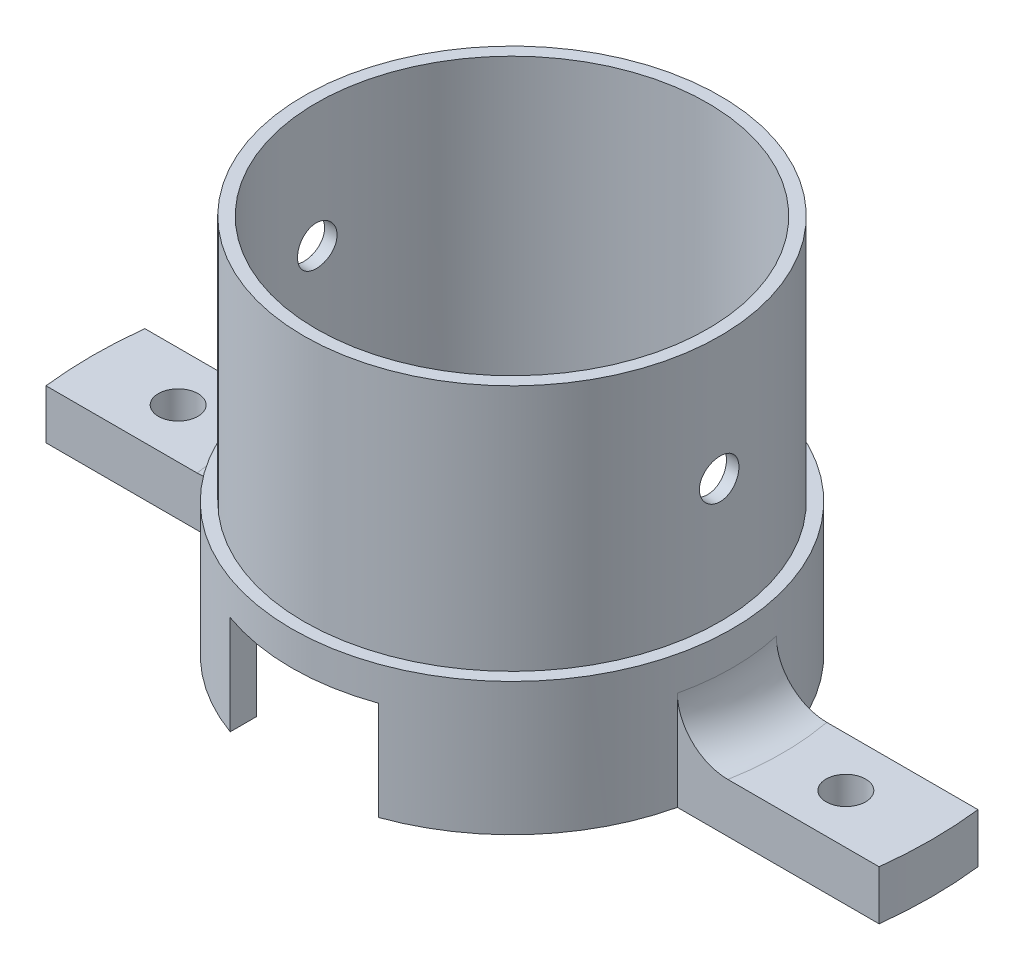
from build123d import *

# Parameters (mm, degrees)
SKETCH1_R                = 34
BOSS_EXTRUDE1_DEPTH      = 10
SKETCH2_R                = 19.7871926
SKETCH2_R_2              = 2
CUT_EXTRUDE1_DEPTH       = 10
SKETCH3_R                = 4.837531333
SKETCH4_W                = 4.837531333
SKETCH4_H                = 4.837531333
CUT_EXTRUDE3_DEPTH       = 38
CUT_EXTRUDE3_DEPTH_BACK  = 38
SKETCH5_W                = 72.361656805
SKETCH5_H                = 8.896778435
BOSS_EXTRUDE2_START      = 60
SKETCH6_R                = 22.2871926
SKETCH6_R_2              = 19.7871926
BOSS_EXTRUDE2_DEPTH      = 60
SKETCH7_R                = 21.0371926
SKETCH7_R_2              = 19.7871926
CUT_EXTRUDE4_DEPTH       = 25
CUT_EXTRUDE6_DEPTH       = 25
CUT_EXTRUDE6_DEPTH_BACK  = 25
SKETCH8_R                = 2
CUT_EXTRUDE7_DEPTH       = 43
CUT_EXTRUDE7_DEPTH_BACK  = 53
SKETCH9_W                = 69.351432881
SKETCH9_H                = 5.737807944
CUT_EXTRUDE8_START       = -25
SKETCH10_R               = 22.2871926
SKETCH10_R_2             = 21.0371926
CUT_EXTRUDE8_DEPTH       = 25
CUT_EXTRUDE9_DEPTH       = 30
CUT_EXTRUDE9_DEPTH_BACK  = 30
SKETCH11_R               = 2
CUT_EXTRUDE10_DEPTH      = 30
CUT_EXTRUDE10_DEPTH_BACK = 30
SKETCH12_W               = 44.5743852
SKETCH12_H               = 21.576749043
BOSS_EXTRUDE3_DEPTH      = 66
BOSS_EXTRUDE3_DEPTH_BACK = 54
SKETCH13_W               = 10
SKETCH13_H               = 10
CUT_EXTRUDE11_START      = -66
SKETCH14_R               = 19.7871926
CUT_EXTRUDE11_DEPTH      = 66
SKETCH18_W               = 9.329915791
SKETCH18_H               = 10
CUT_EXTRUDE12_DEPTH      = 66
SKETCH19_R               = 2
CUT_EXTRUDE13_DEPTH      = 66
SKETCH20_R               = 58.570053226
SKETCH20_R_2             = 42.40739525
CUT_EXTRUDE14_DEPTH      = 66
SKETCH22_R               = 21.0371926
SKETCH22_R_2             = 19.7871926
BOSS_EXTRUDE4_DEPTH      = 12
CUT_EXTRUDE15_DEPTH      = 66
CUT_EXTRUDE15_DEPTH_BACK = 66
SKETCH21_W               = 15
SKETCH21_H               = 10


with BuildPart() as part:
    # Sketch1 → Boss-Extrude1 (new body)
    with BuildSketch(Plane(origin=(0, 0, 0), x_dir=(1, 0, 0), z_dir=(0, 1, 0))):
        Circle(SKETCH1_R)
    extrude(amount=BOSS_EXTRUDE1_DEPTH)

    # Sketch2 → Cut-Extrude1 (cut)
    with BuildSketch(Plane.XZ):
        Circle(SKETCH2_R)
        with Locations((-22.1, 12.5)):
            Circle(SKETCH2_R_2)
        with Locations((22.1, 12.5)):
            Circle(SKETCH2_R_2)
        with Locations((22.1, -12.5)):
            Circle(SKETCH2_R_2)
        with Locations((-22.1, -12.5)):
            Circle(SKETCH2_R_2)
    extrude(amount=-CUT_EXTRUDE1_DEPTH, mode=Mode.SUBTRACT)

    # Sketch3 → Cut-Revolve1 (revolve, cut)
    with BuildSketch(Plane(origin=(0, 0, 0), x_dir=(0, 0, -1), z_dir=(1, 0, 0))):
        with Locations((-34, 5)):
            Circle(SKETCH3_R)
    revolve(axis=Axis((0, 0, 0), (0, 1, 0)), mode=Mode.SUBTRACT)

    # Sketch4 → Cut-Revolve2 (revolve, cut)
    with BuildSketch(Plane(origin=(0, 0, 0), x_dir=(0, 0, -1), z_dir=(1, 0, 0))):
        with Locations((-31.581234333, 2.581234333)):
            Rectangle(SKETCH4_W, SKETCH4_H)
    revolve(axis=Axis((0, 0, 0), (0, 1, 0)), mode=Mode.SUBTRACT)

    # Sketch5 → Cut-Extrude3 (cut, two sides: drawn at the far end of the back side and taken through both)
    with BuildSketch(Plane(origin=(0, 0, 0), x_dir=(0, 0, -1), z_dir=(1, 0, 0)).offset(-CUT_EXTRUDE3_DEPTH_BACK)):
        with Locations((-0.901301775, 0.551610782)):
            Rectangle(SKETCH5_W, SKETCH5_H)
    extrude(amount=CUT_EXTRUDE3_DEPTH + CUT_EXTRUDE3_DEPTH_BACK, mode=Mode.SUBTRACT)

    # Sketch6 → Boss-Extrude2 (add)
    with BuildSketch(Plane.XZ.offset(-5).offset(BOSS_EXTRUDE2_START)):
        Circle(SKETCH6_R)
        Circle(SKETCH6_R_2, mode=Mode.SUBTRACT)
    extrude(amount=-BOSS_EXTRUDE2_DEPTH)

    # Sketch7 → Cut-Extrude4 (cut)
    with BuildSketch(Plane.XZ.offset(55)):
        Circle(SKETCH7_R)
        Circle(SKETCH7_R_2, mode=Mode.SUBTRACT)
    extrude(amount=-CUT_EXTRUDE4_DEPTH, mode=Mode.SUBTRACT)

    # Sketch8 → Cut-Extrude6 (cut, two sides: drawn at the far end of the back side and taken through both)
    with BuildSketch(Plane(origin=(0, 0, 0), x_dir=(0, 0, -1), z_dir=(1, 0, 0)).offset(-CUT_EXTRUDE6_DEPTH_BACK)):
        with Locations((0, -42.5)):
            Circle(SKETCH8_R)
    extrude(amount=CUT_EXTRUDE6_DEPTH + CUT_EXTRUDE6_DEPTH_BACK, mode=Mode.SUBTRACT)

    # Sketch9 → Cut-Extrude7 (cut, two sides: drawn at the far end of the back side and taken through both)
    with BuildSketch(Plane(origin=(0, 0, 0), x_dir=(0, 0, -1), z_dir=(1, 0, 0)).offset(-CUT_EXTRUDE7_DEPTH_BACK)):
        with Locations((0.165912519, 7.868903972)):
            Rectangle(SKETCH9_W, SKETCH9_H)
    extrude(amount=CUT_EXTRUDE7_DEPTH + CUT_EXTRUDE7_DEPTH_BACK, mode=Mode.SUBTRACT)

    # Sketch10 → Cut-Extrude8 (cut)
    with BuildSketch(Plane(origin=(0, 5, 0), x_dir=(1, 0, 0), z_dir=(0, 1, 0)).offset(CUT_EXTRUDE8_START)):
        Circle(SKETCH10_R)
        Circle(SKETCH10_R_2, mode=Mode.SUBTRACT)
    extrude(amount=CUT_EXTRUDE8_DEPTH, mode=Mode.SUBTRACT)

    # Sketch11 → Cut-Extrude9 (cut, two sides: drawn at the far end of the back side and taken through both)
    with BuildSketch(Plane(origin=(0, 0, 0), x_dir=(0, 0, -1), z_dir=(1, 0, 0)).offset(-CUT_EXTRUDE9_DEPTH_BACK)):
        with Locations((0, -7.5)):
            Circle(SKETCH11_R)
    extrude(amount=CUT_EXTRUDE9_DEPTH + CUT_EXTRUDE9_DEPTH_BACK, mode=Mode.SUBTRACT)

    # Sketch12 → Cut-Extrude10 (cut, two sides: drawn at the far end of the back side and taken through both)
    with BuildSketch(Plane(origin=(0, 0, 0), x_dir=(0, 0, -1), z_dir=(1, 0, 0)).offset(-CUT_EXTRUDE10_DEPTH_BACK)):
        with Locations((0, -44.211625478)):
            Rectangle(SKETCH12_W, SKETCH12_H)
    extrude(amount=CUT_EXTRUDE10_DEPTH + CUT_EXTRUDE10_DEPTH_BACK, mode=Mode.SUBTRACT)

    # Sketch13 → Boss-Extrude3 (add, two sides: drawn at the far end of the back side and taken through both)
    with BuildSketch(Plane(origin=(0, 0, 0), x_dir=(0, 0, -1), z_dir=(1, 0, 0)).offset(-BOSS_EXTRUDE3_DEPTH_BACK)):
        with Locations((0, -28.423250957)):
            Rectangle(SKETCH13_W, SKETCH13_H)
    extrude(amount=BOSS_EXTRUDE3_DEPTH + BOSS_EXTRUDE3_DEPTH_BACK)

    # Sketch14 → Cut-Extrude11 (cut)
    with BuildSketch(Plane(origin=(0, -23.423250957, 0), x_dir=(1, 0, 0), z_dir=(0, 1, 0)).offset(CUT_EXTRUDE11_START)):
        Circle(SKETCH14_R)
    extrude(amount=CUT_EXTRUDE11_DEPTH, mode=Mode.SUBTRACT)

    # Sketch17 → Cut-Revolve5 (revolve, cut)
    with BuildSketch(Plane.XY):
        with BuildLine():
            Line((-32.2871926, -23.423250957), (-56.890231537, -23.423250957))
            Line((-56.890231537, -23.423250957), (-56.890231537, -28.423250957))
            Line((-56.890231537, -28.423250957), (-27.2871926, -28.423250957))
            ThreePointArc((-27.2871926, -28.423250957), (-23.751658694, -19.887717051), (-32.2871926, -23.423250957))
        make_face()
    revolve(axis=Axis((0, -33.423250957, 0), (0, 1, 0)), mode=Mode.SUBTRACT)

    # Sketch18 → Cut-Extrude12 (cut)
    with BuildSketch(Plane.XY.offset(5)):
        with Locations((61.335042105, -28.423250957)):
            Rectangle(SKETCH18_W, SKETCH18_H)
    extrude(amount=-CUT_EXTRUDE12_DEPTH, mode=Mode.SUBTRACT)

    # Sketch19 → Cut-Extrude13 (cut)
    with BuildSketch(Plane.XZ.offset(33.423250957)):
        with Locations((-33.75, 0)):
            Circle(SKETCH19_R)
        with Locations((33.75, 0)):
            Circle(SKETCH19_R)
    extrude(amount=-CUT_EXTRUDE13_DEPTH, mode=Mode.SUBTRACT)

    # Sketch20 → Cut-Extrude14 (cut)
    with BuildSketch(Plane.XZ.offset(33.423250957)):
        Circle(SKETCH20_R)
        Circle(SKETCH20_R_2, mode=Mode.SUBTRACT)
    extrude(amount=-CUT_EXTRUDE14_DEPTH, mode=Mode.SUBTRACT)

    # Sketch22 → Boss-Extrude4 (add)
    with BuildSketch(Plane.XZ.offset(33.423250957)):
        Circle(SKETCH22_R)
        Circle(SKETCH22_R_2, mode=Mode.SUBTRACT)
    extrude(amount=-BOSS_EXTRUDE4_DEPTH)

    # Sketch21 → Cut-Extrude15 (cut, two sides: drawn at the far end of the back side and taken through both)
    with BuildSketch(Plane(origin=(0, 0, -5), x_dir=(-1, 0, 0), z_dir=(0, 0, -1)).offset(-CUT_EXTRUDE15_DEPTH_BACK)):
        with Locations((0, -28.423250957)):
            Rectangle(SKETCH21_W, SKETCH21_H)
    extrude(amount=CUT_EXTRUDE15_DEPTH + CUT_EXTRUDE15_DEPTH_BACK, mode=Mode.SUBTRACT)


solid = part.part
